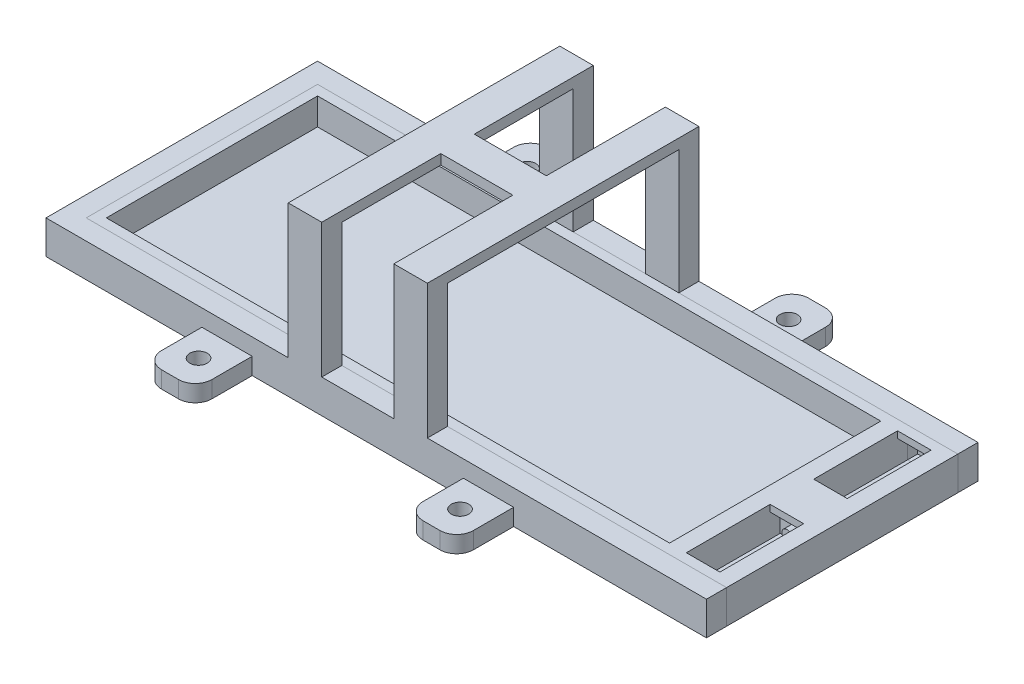
from build123d import *

# Parameters (mm, degrees)
SKETCH1_W                      = 168
SKETCH1_H                      = 63
BOSS_EXTRUDE1_DEPTH            = 10
SKETCH2_W                      = 168
SKETCH2_H                      = 63
BOSS_EXTRUDE2_DEPTH            = 2
SKETCH3_W                      = 10
SKETCH3_H                      = 25
CUT_EXTRUDE1_DEPTH             = 111.028405423
SKETCH4_W                      = 10
SKETCH4_H                      = 8
CUT_EXTRUDE2_DEPTH             = 3
CUT_EXTRUDE2_DIRECTION_2_REACH = 114.236
SKETCH6_W                      = 10
SKETCH6_H                      = 1
BOSS_EXTRUDE4_DEPTH            = 31
SKETCH7_R                      = 1.5
BOSS_EXTRUDE5_DEPTH            = 3
BOSS_EXTRUDE6_DEPTH            = 10
SKETCH16_W                     = 10.5
SKETCH16_H                     = 5.5
CUT_EXTRUDE5_DEPTH             = 3
SKETCH15_W                     = 10
SKETCH15_H                     = 7
CUT_EXTRUDE6_DEPTH             = 3
SKETCH17_W                     = 15
SKETCH17_H                     = 5
BOSS_EXTRUDE7_DEPTH            = 17
SKETCH18_R                     = 2.6
CUT_EXTRUDE7_DEPTH             = 5
FILLET1_R                      = 5
FILLET1_OF_MIRROR8_R           = 5
SKETCH19_W                     = 10
SKETCH19_H                     = 6
BOSS_EXTRUDE8_DEPTH            = 40
BOSS_EXTRUDE9_REACH            = 149.58
SKETCH20_W                     = 10
SKETCH20_H                     = 3
BOSS_EXTRUDE10_REACH           = 139.745
SKETCH21_W                     = 10
SKETCH21_H                     = 3


with BuildPart() as part:
    # Sketch1 → Boss-Extrude1 (new body)
    with BuildSketch(Plane(origin=(0, 0, 0), x_dir=(1, 0, 0), z_dir=(0, 1, 0))):
        Polygon((0, 34.5), (-87, 34.5), (-87, -34.5), (84, -34.5), (104, -34.5), (104, 34.5), (84, 34.5), align=None)
        Rectangle(SKETCH1_W, SKETCH1_H, mode=Mode.SUBTRACT)
    extrude(amount=BOSS_EXTRUDE1_DEPTH)

    # Sketch2 → Boss-Extrude2 (add)
    with BuildSketch(Plane(origin=(0, 0, 0), x_dir=(1, 0, 0), z_dir=(0, 1, 0))):
        Rectangle(SKETCH2_W, SKETCH2_H)
    extrude(amount=BOSS_EXTRUDE2_DEPTH)

    # Sketch3 → Cut-Extrude1 (cut, through all)
    with BuildSketch(Plane(origin=(0, 10, 0), x_dir=(1, 0, 0), z_dir=(0, 1, 0))):
        with Locations((94, 19)):
            Rectangle(SKETCH3_W, SKETCH3_H)
    cut_extrude1 = extrude(amount=-CUT_EXTRUDE1_DEPTH, mode=Mode.SUBTRACT)

    # Mirror1: Cut-Extrude1 across plane
    add(cut_extrude1.mirror(Plane.XY), mode=Mode.SUBTRACT)

    # Sketch4 → Cut-Extrude2 (cut)
    with BuildSketch(Plane.XY.offset(6.5)):
        with Locations((94, 4)):
            Rectangle(SKETCH4_W, SKETCH4_H)
    cut_extrude2 = extrude(amount=-CUT_EXTRUDE2_DEPTH, mode=Mode.SUBTRACT)

    # Sketch4 → Cut-Extrude2 direction 2 (cut, up to next)
    with BuildSketch(Plane.XY.offset(6.5), mode=Mode.PRIVATE) as cut_extrude2_direction_2_sk1:
        with Locations((94, 4)):
            Rectangle(SKETCH4_W, SKETCH4_H)
    cut_extrude2_direction_2_tool1 = extrude(cut_extrude2_direction_2_sk1.sketch, amount=CUT_EXTRUDE2_DIRECTION_2_REACH, mode=Mode.PRIVATE) & part.part
    cut_extrude2_direction_2 = cut_extrude2_direction_2_tool1.solids().sort_by_distance((94, 4, 6.5))[0]
    add(cut_extrude2_direction_2, mode=Mode.SUBTRACT)

    # Mirror2: Cut-Extrude2, Cut-Extrude2 direction 2 across plane
    add(cut_extrude2.mirror(Plane.XY), mode=Mode.SUBTRACT)
    add(cut_extrude2_direction_2.mirror(Plane.XY), mode=Mode.SUBTRACT)

    # Sketch6 → Boss-Extrude4 (add)
    with BuildSketch(Plane.XY.offset(3.5)):
        with Locations((94, 0.5)):
            Rectangle(SKETCH6_W, SKETCH6_H)
    boss_extrude4 = extrude(amount=BOSS_EXTRUDE4_DEPTH)

    # Mirror5: Boss-Extrude4 across plane
    add(boss_extrude4.mirror(Plane.XY))

    # Sketch7 → Boss-Extrude5 (add)
    with BuildSketch(Plane.XY.offset(3.5)):
        with Locations((94, 4.5)):
            Circle(SKETCH7_R)
    boss_extrude5 = extrude(amount=BOSS_EXTRUDE5_DEPTH)

    # Mirror6: Boss-Extrude5 across plane
    add(boss_extrude5.mirror(Plane.XY))


with BuildPart() as body_2:
    # Sketch8 → Boss-Extrude6 (new body)
    with BuildSketch(Plane(origin=(0, 0, 0), x_dir=(1, 0, 0), z_dir=(0, 1, 0))):
        Polygon((104, -34.5), (104, -40.5), (-93, -40.5), (-93, 40.5), (104, 40.5), (104, 34.5), (-87, 34.5), (-87, -34.5), align=None)
    extrude(amount=BOSS_EXTRUDE6_DEPTH)

    # Sketch16 → Cut-Extrude5 (cut)
    with BuildSketch(Plane(origin=(-87, 0, 0), x_dir=(0, 0, -1), z_dir=(1, 0, 0))):
        with Locations((0, 2.75)):
            Rectangle(SKETCH16_W, SKETCH16_H)
    extrude(amount=-CUT_EXTRUDE5_DEPTH, mode=Mode.SUBTRACT)

    # Sketch15 → Cut-Extrude6 (cut)
    with BuildSketch(Plane(origin=(0, 0, 34.5), x_dir=(-1, 0, 0), z_dir=(0, 0, -1))):
        with Locations((-94, 4.5)):
            Rectangle(SKETCH15_W, SKETCH15_H)
    cut_extrude6 = extrude(amount=-CUT_EXTRUDE6_DEPTH, mode=Mode.SUBTRACT)

    # Mirror7: Cut-Extrude6 across plane
    add(cut_extrude6.mirror(Plane.XY), mode=Mode.SUBTRACT)

    # Sketch17 → Boss-Extrude7 (add)
    with BuildSketch(Plane.XY.offset(40.5)):
        with Locations((-39, 2.5)):
            Rectangle(SKETCH17_W, SKETCH17_H)
        with Locations((39, 2.5)):
            Rectangle(SKETCH17_W, SKETCH17_H)
    boss_extrude7 = extrude(amount=BOSS_EXTRUDE7_DEPTH)

    # Sketch18 → Cut-Extrude7 (cut)
    with BuildSketch(Plane(origin=(0, 5, 0), x_dir=(1, 0, 0), z_dir=(0, 1, 0))):
        with Locations(Location((-39, -49, 0), (0, 0, 180))):
            Circle(SKETCH18_R)
        with Locations(Location((39, -49, 0), (0, 0, 180))):
            Circle(SKETCH18_R)
    cut_extrude7 = extrude(amount=-CUT_EXTRUDE7_DEPTH, mode=Mode.SUBTRACT)

    # Fillet1
    fillet1_edges = [body_2.edges().sort_by_distance(p)[0] for p in [
        (-46.5, 2.5, 57.5),
        (-31.5, 2.5, 57.5),
        (31.5, 2.5, 57.5),
        (46.5, 2.5, 57.5),
    ]]
    fillet(fillet1_edges, radius=FILLET1_R)

    # Mirror8: Boss-Extrude7, Cut-Extrude7 across plane
    add(boss_extrude7.mirror(Plane.XY))
    add(cut_extrude7.mirror(Plane.XY), mode=Mode.SUBTRACT)

    # Fillet1 of Mirror8
    fillet1_of_mirror8_edges = [body_2.edges().sort_by_distance(p)[0] for p in [
        (-46.5, 2.5, -57.5),
        (-31.5, 2.5, -57.5),
        (31.5, 2.5, -57.5),
        (46.5, 2.5, -57.5),
    ]]
    fillet(fillet1_of_mirror8_edges, radius=FILLET1_OF_MIRROR8_R)

    # Sketch19 → Boss-Extrude8 (add)
    with BuildSketch(Plane(origin=(0, 10, 0), x_dir=(1, 0, 0), z_dir=(0, 1, 0))):
        with Locations((-15.75, -37.5)):
            Rectangle(SKETCH19_W, SKETCH19_H)
        with Locations((15.75, -37.5)):
            Rectangle(SKETCH19_W, SKETCH19_H)
    boss_extrude8 = extrude(amount=BOSS_EXTRUDE8_DEPTH)

    # Mirror9: Boss-Extrude8 across plane
    add(boss_extrude8.mirror(Plane.XY))

    # Sketch20 → Boss-Extrude9 (add, up to next)
    with BuildSketch(Plane(origin=(0, 0, 34.5), x_dir=(-1, 0, 0), z_dir=(0, 0, -1)), mode=Mode.PRIVATE) as boss_extrude9_sk1:
        with Locations((-15.75, 48.5)):
            Rectangle(SKETCH20_W, SKETCH20_H)
    boss_extrude9_tool1 = extrude(boss_extrude9_sk1.sketch, amount=BOSS_EXTRUDE9_REACH, mode=Mode.PRIVATE) - body_2.part
    boss_extrude9 = boss_extrude9_tool1.solids().sort_by_distance((15.75, 48.5, 34.5))[0]
    add(boss_extrude9)

    # Mirror10: Boss-Extrude9 across plane
    add(boss_extrude9.mirror(Plane(origin=(0, 0, 0), x_dir=(0, 0, 1), z_dir=(1, 0, 0))))

    # Sketch21 → Boss-Extrude10 (add, up to next)
    with BuildSketch(Plane(origin=(-10.75, 0, 0), x_dir=(0, 0, -1), z_dir=(1, 0, 0)), mode=Mode.PRIVATE) as boss_extrude10_sk1:
        with Locations((0, 48.5)):
            Rectangle(SKETCH21_W, SKETCH21_H)
    boss_extrude10_tool1 = extrude(boss_extrude10_sk1.sketch, amount=BOSS_EXTRUDE10_REACH, mode=Mode.PRIVATE) - body_2.part
    add(boss_extrude10_tool1.solids().sort_by_distance((-10.75, 48.5, 0))[0])


solid = Compound([part.part, body_2.part])
